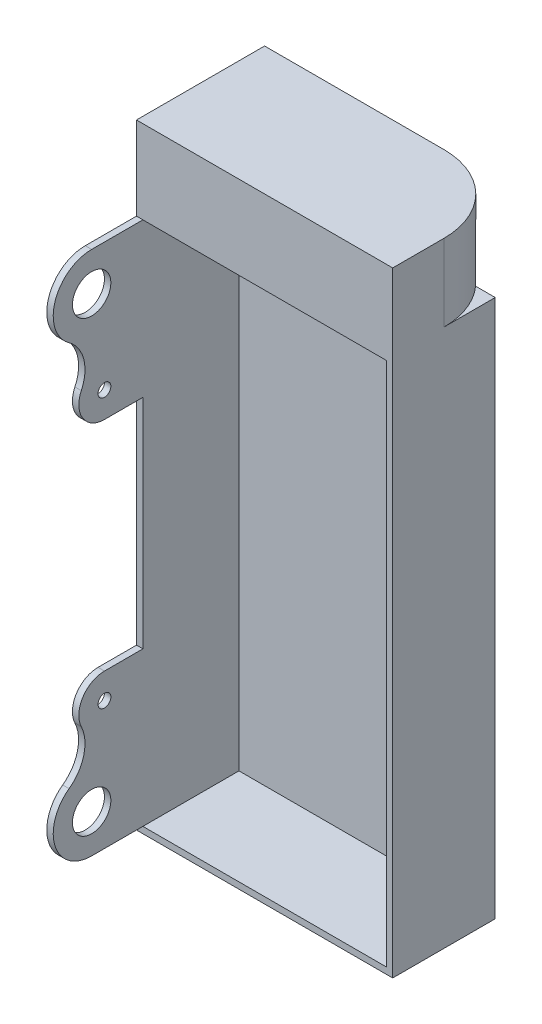
from build123d import *

# Parameters (mm, degrees)
SKETCH1_W           = 127
SKETCH1_H           = 266.7
BOSS_EXTRUDE1_DEPTH = 25.4
SHELL1_T            = -3.175
SKETCH2_R           = 9.525
SKETCH2_R_2         = 3.175
BOSS_EXTRUDE2_DEPTH = 3.175
BOSS_EXTRUDE3_DEPTH = 38.1


with BuildPart() as part:
    # Sketch1 → Boss-Extrude1 (new, symmetric)
    with BuildSketch(Plane.XY):
        Rectangle(SKETCH1_W, SKETCH1_H)
    extrude(amount=BOSS_EXTRUDE1_DEPTH, both=True)

    # Shell1
    shell1_openings = [part.faces().sort_by_distance(p)[0] for p in [
        (0, 0, 25.4),
    ]]
    offset(amount=SHELL1_T, openings=shell1_openings, kind=Kind.INTERSECTION)

    # Sketch2 → Boss-Extrude2 (add)
    with BuildSketch(Plane.ZY.offset(63.5)):
        with BuildLine():
            Line((50.8, 130.175), (25.4, 130.175))
            Line((25.4, 130.175), (25.4, 53.975))
            Line((25.4, 53.975), (44.45, 53.975))
            ThreePointArc((44.45, 53.975), (55.181439518, 59.883372369), (55.927786008, 72.11103057))
            ThreePointArc((55.927786008, 72.11103057), (54.690903616, 84.99461885), (61.97223251, 95.695038213))
            ThreePointArc((61.97223251, 95.695038213), (68.922407015, 116.99704087), (50.8, 130.175))
        make_face()
        with Locations(Location((50.8, 111.125, 0), (0, 0, 270))):
            Circle(SKETCH2_R, mode=Mode.SUBTRACT)
        with Locations(Location((44.45, 66.675, 0), (0, 0, 270))):
            Circle(SKETCH2_R_2, mode=Mode.SUBTRACT)
    boss_extrude2 = extrude(amount=-BOSS_EXTRUDE2_DEPTH)

    # Sketch3 → Boss-Extrude3 (add)
    with BuildSketch(Plane(origin=(0, 133.35, 0), x_dir=(1, 0, 0), z_dir=(0, 1, 0))):
        with BuildLine():
            Line((63.5, -25.4), (-63.5, -25.4))
            Line((-63.5, -25.4), (-63.5, 38.1))
            Line((-63.5, 38.1), (25.4, 38.1))
            ThreePointArc((25.4, 38.1), (52.340768363, 26.940768363), (63.5, 0))
            Line((63.5, 0), (63.5, -25.4))
        make_face()
    extrude(amount=BOSS_EXTRUDE3_DEPTH)

    # Mirror1: Boss-Extrude2 across plane
    add(boss_extrude2.mirror(Plane.ZX))


solid = part.part
